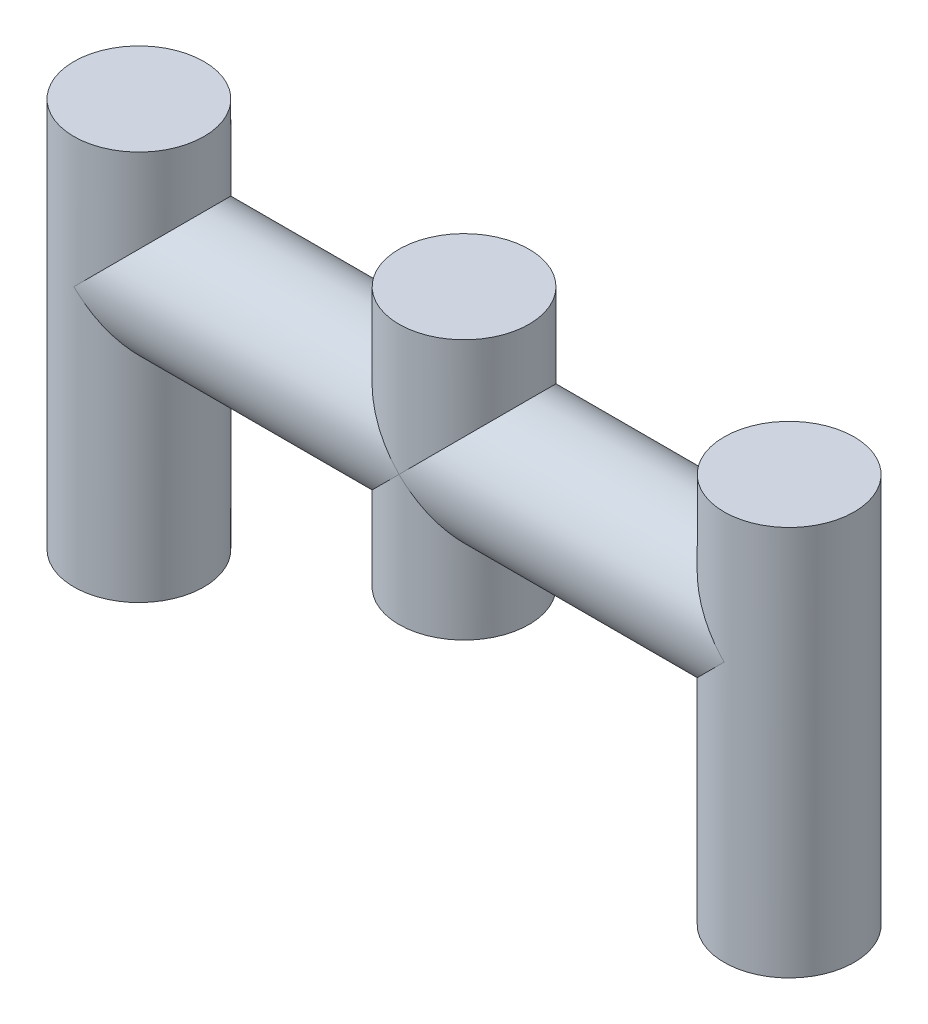
from build123d import *

# Parameters (mm, degrees)
SKETCH2_R           = 2.5
BOSS_EXTRUDE2_DEPTH = 10
SKETCH3_R           = 2.5
BOSS_EXTRUDE3_DEPTH = 12.5
BOSS_EXTRUDE4_DEPTH = 10
BOSS_EXTRUDE5_START = 5
SKETCH5_R           = 2.5
BOSS_EXTRUDE5_DEPTH = 5


with BuildPart() as part:
    # Sketch2 → Boss-Extrude2 (new body)
    with BuildSketch(Plane(origin=(0, 0, 0), x_dir=(1, 0, 0), z_dir=(0, 1, 0))):
        with Locations(Location((0, 0, 0), (0, 0, 270))):
            Circle(SKETCH2_R)
    boss_extrude2 = extrude(amount=BOSS_EXTRUDE2_DEPTH)

    # Sketch3 → Boss-Extrude3 (add)
    with BuildSketch(Plane(origin=(0, 0, 0), x_dir=(0, 0, -1), z_dir=(1, 0, 0))):
        with Locations((0, 5)):
            Circle(SKETCH3_R)
    boss_extrude3 = extrude(amount=BOSS_EXTRUDE3_DEPTH)

    # Sketch4 → Boss-Extrude4 (add)
    with BuildSketch(Plane(origin=(0, 0, 0), x_dir=(1, 0, 0), z_dir=(0, 1, 0))):
        with BuildLine():
            Line((12.5, 2.5), (12.5, -2.5))
            ThreePointArc((12.5, -2.5), (10, 0), (12.5, 2.5))
        make_face()
    boss_extrude4 = extrude(amount=BOSS_EXTRUDE4_DEPTH)

    # Mirror5: Boss-Extrude2, Boss-Extrude3, Boss-Extrude4 across plane
    add(boss_extrude2.mirror(Plane(origin=(12.5, 5, 0), x_dir=(0, 0, 1), z_dir=(1, 0, 0))))
    add(boss_extrude3.mirror(Plane(origin=(12.5, 5, 0), x_dir=(0, 0, 1), z_dir=(1, 0, 0))))
    add(boss_extrude4.mirror(Plane(origin=(12.5, 5, 0), x_dir=(0, 0, 1), z_dir=(1, 0, 0))))

    # Sketch5 → Boss-Extrude5 (add)
    with BuildSketch(Plane.XZ.offset(BOSS_EXTRUDE5_START)):
        with Locations(Location((0, 0, 0), (0, 0, 270))):
            Circle(SKETCH5_R)
        with Locations(Location((25, 0, 0), (0, 0, 270))):
            Circle(SKETCH5_R)
    extrude(amount=-BOSS_EXTRUDE5_DEPTH)


solid = part.part
